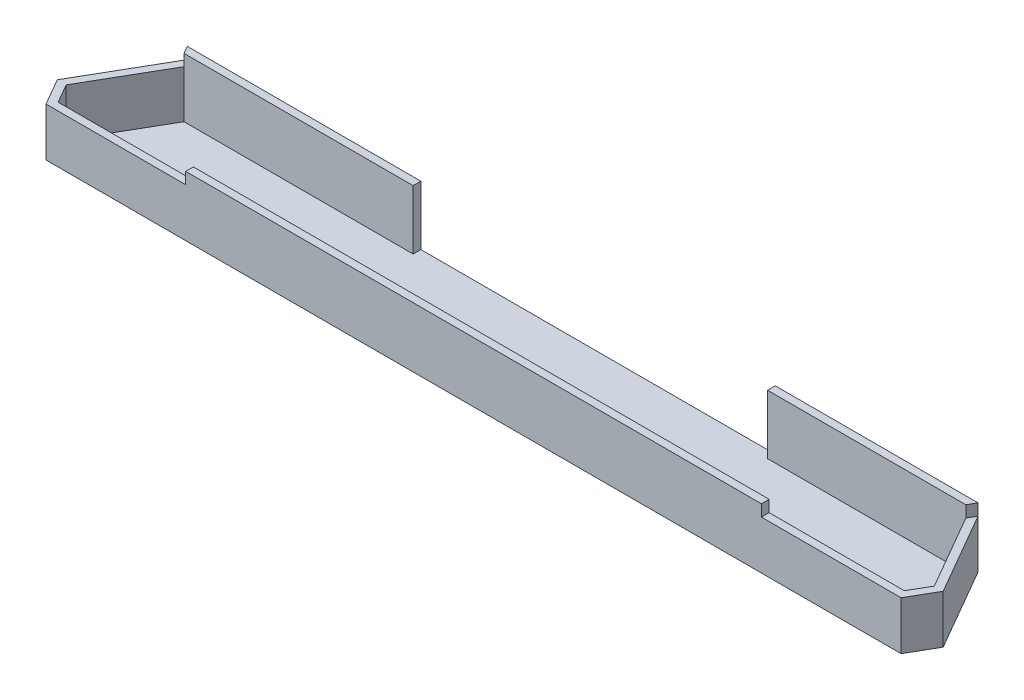
from build123d import *

# Parameters (mm, degrees)
BOSS_EXTRUDE1_DEPTH = 0.2
BOSS_EXTRUDE2_DEPTH = 12.58
SKETCH1_4_W         = 149.48
SKETCH1_4_H         = 2
BOSS_EXTRUDE3_DEPTH = 15.58


with BuildPart() as part:
    # Sketch1 → Boss-Extrude1 (new body)
    with BuildSketch(Plane(origin=(0, 0, 0), x_dir=(1, 0, 0), z_dir=(0, 1, 0))):
        Polygon((-42.01, 19.39179677), (-101.494739838, 19.39179677), (-112.690598923, 0), (-109.845299462, -4.92820323), (-74.74, -4.92820323), (74.74, -4.92820323), (109.845299462, -4.92820323), (112.690598923, 0), (101.494739838, 19.39179677), (50.01, 19.39179677), (50.01, 21.39179677), (-42.01, 21.39179677), align=None)
    extrude(amount=BOSS_EXTRUDE1_DEPTH)

    # Sketch1<3> → Boss-Extrude2 (add)
    with BuildSketch(Plane(origin=(0, 0, 0), x_dir=(1, 0, 0), z_dir=(0, 1, 0))):
        Polygon((-115, 0), (-111, -6.92820323), (-74.74, -6.92820323), (-74.74, -4.92820323), (-109.845299462, -4.92820323), (-112.690598923, 0), (-101.494739838, 19.39179677), (-102.649440377, 21.39179677), align=None)
        Polygon((115, 0), (111, -6.92820323), (74.74, -6.92820323), (74.74, -4.92820323), (109.845299462, -4.92820323), (112.690598923, 0), (101.494739838, 19.39179677), (102.649440377, 21.39179677), align=None)
    extrude(amount=BOSS_EXTRUDE2_DEPTH)

    # Sketch1<4> → Boss-Extrude3 (add)
    with BuildSketch(Plane(origin=(0, 0, 0), x_dir=(1, 0, 0), z_dir=(0, 1, 0))):
        Polygon((-42.01, 21.39179677), (-102.649440377, 21.39179677), (-101.494739838, 19.39179677), (-42.01, 19.39179677), align=None)
        with Locations((0, -5.92820323)):
            Rectangle(SKETCH1_4_W, SKETCH1_4_H)
        Polygon((102.649440377, 21.39179677), (50.01, 21.39179677), (50.01, 19.39179677), (101.494739838, 19.39179677), align=None)
    extrude(amount=BOSS_EXTRUDE3_DEPTH)


solid = part.part
